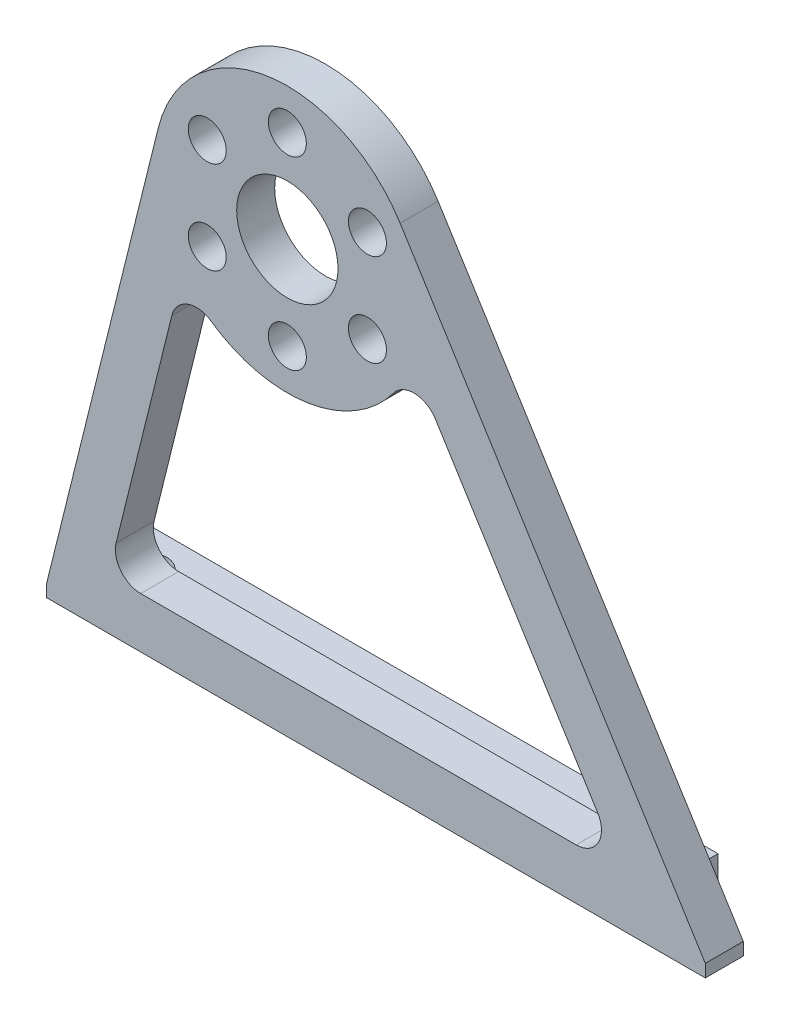
from build123d import *

# Parameters (mm, degrees)
SKETCH_1_R          = 4
SKETCH_1_R_2        = 1.5
EXTRUDE_1_DEPTH     = 6
SKETCH_4_R          = 1.5
CUT_EXTRUDE_2_DEPTH = 3
CUT_EXTRUDE_3_DEPTH = 3


with BuildPart() as part:
    # 草图1 → 凸台-拉伸1 (new body)
    with BuildSketch(Plane.XY):
        with BuildLine():
            Line((-10.191413347, 2.526874351), (-19, -33))
            Line((-19, -33), (-19, -34))
            Line((-19, -34), (33, -34))
            Line((33, -34), (33, -33))
            Line((33, -33), (8.904718959, 5.563809869))
            ThreePointArc((8.904718959, 5.563809869), (-1.649133089, 10.369684665), (-10.191413347, 2.526874351))
        make_face()
        Circle(SKETCH_1_R, mode=Mode.SUBTRACT)
        with Locations((0, 7.3)):
            Circle(SKETCH_1_R_2, mode=Mode.SUBTRACT)
        with Locations((6.321985448, 3.65)):
            Circle(SKETCH_1_R_2, mode=Mode.SUBTRACT)
        with Locations((6.321985448, -3.65)):
            Circle(SKETCH_1_R_2, mode=Mode.SUBTRACT)
        with Locations((0, -7.3)):
            Circle(SKETCH_1_R_2, mode=Mode.SUBTRACT)
        with Locations((-6.321985448, -3.65)):
            Circle(SKETCH_1_R_2, mode=Mode.SUBTRACT)
        with Locations((-6.321985448, 3.65)):
            Circle(SKETCH_1_R_2, mode=Mode.SUBTRACT)
        with BuildLine():
            Line((-9.115462127, -9.754914157), (-13.519839571, -27.5186906))
            ThreePointArc((-13.519839571, -27.5186906), (-13.153835237, -29.232351654), (-11.578617982, -30))
            Line((-11.578617982, -30), (22.801020138, -30))
            ThreePointArc((22.801020138, -30), (24.55024091, -28.969652872), (24.497157083, -26.940226692))
            Line((24.497157083, -26.940226692), (11.69193225, -6.445829679))
            ThreePointArc((11.69193225, -6.445829679), (10.081363796, -5.507434318), (8.396468057, -6.30470651))
            ThreePointArc((8.396468057, -6.30470651), (1.649133089, -10.369684665), (-6.026362051, -8.598427788))
            ThreePointArc((-6.026362051, -8.598427788), (-7.875463398, -8.363181513), (-9.115462127, -9.754914157))
        make_face(mode=Mode.SUBTRACT)
    extrude(amount=EXTRUDE_1_DEPTH)

    # 草图4 → 切除-拉伸2 (cut)
    with BuildSketch(Plane(origin=(0, -34, 0), x_dir=(-1, 0, 0), z_dir=(0, -1, 0))):
        with Locations(Location((14, -3, 0), (0, 0, 90))):
            Circle(SKETCH_4_R)
        with Locations(Location((-23, -3, 0), (0, 0, 90))):
            Circle(SKETCH_4_R)
    extrude(amount=-CUT_EXTRUDE_2_DEPTH, mode=Mode.SUBTRACT)

    # 草图5 → 切除-拉伸3 (cut)
    with BuildSketch(Plane(origin=(0, 0, 0), x_dir=(-1, 0, 0), z_dir=(0, 0, -1))):
        Polygon((22.848175367, -31), (-28, -31), (-28, -36.198371548), (-37.735885528, -36.198371548), (-37.735885528, 13.676691154), (23.360590395, 13.676691154), (23.360590395, -30.988818766), align=None)
    extrude(amount=-CUT_EXTRUDE_3_DEPTH, mode=Mode.SUBTRACT)


solid = part.part
